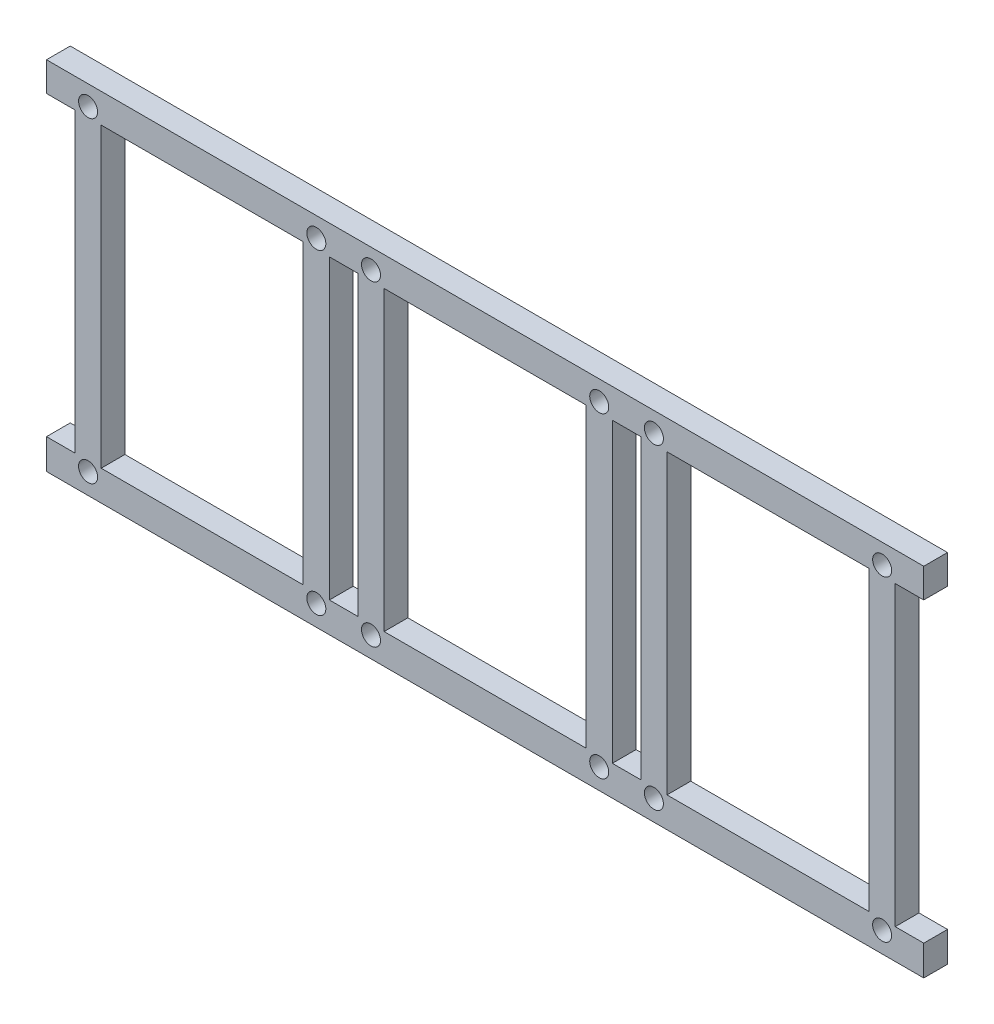
from build123d import *

# Parameters (mm, degrees)
SKETCH_1_R      = 2
SKETCH_1_W      = 42.5
SKETCH_1_H      = 62.5
SKETCH_1_W_2    = 6
EXTRUDE_1_DEPTH = 5


with BuildPart() as part:
    # 草图1 → 凸台-拉伸1 (new body)
    with BuildSketch(Plane.XY):
        Polygon((1909.377089995, 1448.678588443), (2093.877089995, 1448.678588443), (2093.877089995, 1455.029082267), (2087.877089995, 1455.029082267), (2087.877089995, 1517.529082267), (2093.877089995, 1517.529082267), (2093.877089995, 1523.678588443), (1909.377089995, 1523.678588443), (1909.377089995, 1517.529082267), (1915.377089995, 1517.529082267), (1915.377089995, 1455.029082267), (1909.377089995, 1455.029082267), align=None)
        with Locations((1918.127089995, 1453.029082267)):
            Circle(SKETCH_1_R, mode=Mode.SUBTRACT)
        with Locations((1966.127089995, 1453.029082267)):
            Circle(SKETCH_1_R, mode=Mode.SUBTRACT)
        with Locations((1977.627089995, 1453.029082267)):
            Circle(SKETCH_1_R, mode=Mode.SUBTRACT)
        with Locations((2025.627089995, 1453.029082267)):
            Circle(SKETCH_1_R, mode=Mode.SUBTRACT)
        with Locations((2037.127089995, 1453.029082267)):
            Circle(SKETCH_1_R, mode=Mode.SUBTRACT)
        with Locations((2085.127089995, 1453.029082267)):
            Circle(SKETCH_1_R, mode=Mode.SUBTRACT)
        with Locations((1942.127089995, 1486.279082267)):
            Rectangle(SKETCH_1_W, SKETCH_1_H, mode=Mode.SUBTRACT)
        Polygon((1968.877089995, 1455.029082267), (1968.877089995, 1486.279082267), (1968.877089995, 1517.529082267), (1974.877089995, 1517.529082267), (1974.877089995, 1455.029082267), align=None, mode=Mode.SUBTRACT)
        with Locations((1918.127089995, 1519.529082267)):
            Circle(SKETCH_1_R, mode=Mode.SUBTRACT)
        with Locations((1966.127089995, 1519.529082267)):
            Circle(SKETCH_1_R, mode=Mode.SUBTRACT)
        with Locations((1977.627089995, 1519.529082267)):
            Circle(SKETCH_1_R, mode=Mode.SUBTRACT)
        with Locations((2001.627089995, 1486.279082267)):
            Rectangle(SKETCH_1_W, SKETCH_1_H, mode=Mode.SUBTRACT)
        with Locations((2031.377089995, 1486.279082267)):
            Rectangle(SKETCH_1_W_2, SKETCH_1_H, mode=Mode.SUBTRACT)
        with Locations((2061.127089995, 1486.279082267)):
            Rectangle(SKETCH_1_W, SKETCH_1_H, mode=Mode.SUBTRACT)
        with Locations((2025.627089995, 1519.529082267)):
            Circle(SKETCH_1_R, mode=Mode.SUBTRACT)
        with Locations((2037.127089995, 1519.529082267)):
            Circle(SKETCH_1_R, mode=Mode.SUBTRACT)
        with Locations((2085.127089995, 1519.529082267)):
            Circle(SKETCH_1_R, mode=Mode.SUBTRACT)
    extrude(amount=EXTRUDE_1_DEPTH)


solid = part.part
